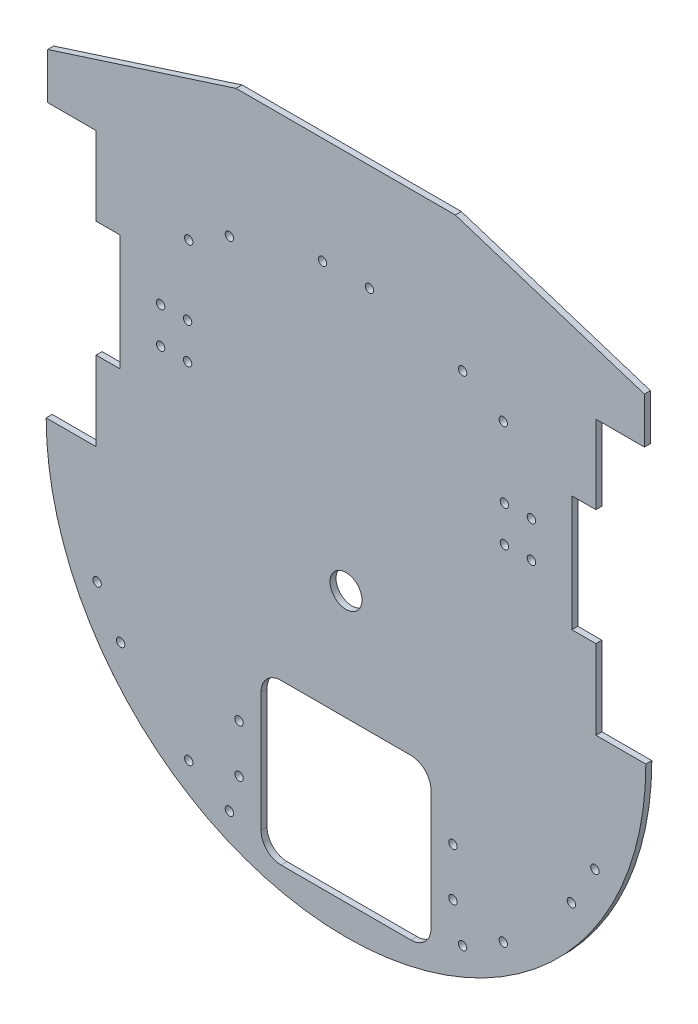
from build123d import *

# Parameters (mm, degrees)
SKETCH_1_R      = 2.1
SKETCH_1_R_2    = 8
EXTRUDE_1_DEPTH = 3


with BuildPart() as part:
    # 草图1 → 拉伸1 (new body)
    with BuildSketch(Plane.XY):
        with BuildLine():
            Line((-150, 0), (-125.000376699, 0))
            Line((-125.000376699, 0), (-125.000376699, 39.69983712))
            Line((-125.000376699, 39.69983712), (-113.000376699, 39.69983712))
            Line((-113.000376699, 39.69983712), (-113.000376699, 97.69983712))
            Line((-113.000376699, 97.69983712), (-125.000376699, 97.69983712))
            Line((-125.000376699, 97.69983712), (-125.000376699, 136.962885218))
            Line((-125.000376699, 136.962885218), (-149.291861287, 136.962885218))
            Line((-149.291861287, 136.962885218), (-149.291861287, 159.962885218))
            Line((-149.291861287, 159.962885218), (-55, 190.24809041))
            Line((-55, 190.24809041), (54.687657428, 190.24809041))
            Line((54.687657428, 190.24809041), (149.291861287, 159.962885218))
            Line((149.291861287, 159.962885218), (149.291861287, 136.962885218))
            Line((149.291861287, 136.962885218), (125.000376699, 136.962885218))
            Line((125.000376699, 136.962885218), (125.000376699, 97.69983712))
            Line((125.000376699, 97.69983712), (113.000376699, 97.69983712))
            Line((113.000376699, 97.69983712), (113.000376699, 39.69983712))
            Line((113.000376699, 39.69983712), (125.000376699, 39.69983712))
            Line((125.000376699, 39.69983712), (125.000376699, 0))
            Line((125.000376699, 0), (150, 0))
            ThreePointArc((150, 0), (0, -150), (-150, 0))
        make_face()
        with Locations((-92.750376699, 77.7)):
            Circle(SKETCH_1_R, mode=Mode.SUBTRACT)
        with Locations(Location((-92.750376699, 59.7, 0), (0, 0, 180))):
            Circle(SKETCH_1_R, mode=Mode.SUBTRACT)
        with Locations((-53.5, -83)):
            Circle(SKETCH_1_R, mode=Mode.SUBTRACT)
        with Locations(Location((-53.5, -107, 0), (0, 0, 180))):
            Circle(SKETCH_1_R, mode=Mode.SUBTRACT)
        with Locations((53.5, -107)):
            Circle(SKETCH_1_R, mode=Mode.SUBTRACT)
        with Locations(Location((53.5, -83, 0), (0, 0, 180))):
            Circle(SKETCH_1_R, mode=Mode.SUBTRACT)
        with Locations((-79.250376699, 59.7)):
            Circle(SKETCH_1_R, mode=Mode.SUBTRACT)
        with Locations(Location((-79.250376699, 77.7, 0), (0, 0, 180))):
            Circle(SKETCH_1_R, mode=Mode.SUBTRACT)
        with Locations(Location((79.250376699, 59.7, 0), (0, 0, 180))):
            Circle(SKETCH_1_R, mode=Mode.SUBTRACT)
        with Locations((92.750376699, 59.7)):
            Circle(SKETCH_1_R, mode=Mode.SUBTRACT)
        with Locations((79.250376699, 77.7)):
            Circle(SKETCH_1_R, mode=Mode.SUBTRACT)
        with Locations(Location((92.750376699, 77.7, 0), (0, 0, 180))):
            Circle(SKETCH_1_R, mode=Mode.SUBTRACT)
        Circle(SKETCH_1_R_2, mode=Mode.SUBTRACT)
        with Locations((-58.324201506, -124.520480318)):
            Circle(SKETCH_1_R, mode=Mode.SUBTRACT)
        with Locations(Location((-78.675798494, -112.770480318, 0), (0, 0, 180))):
            Circle(SKETCH_1_R, mode=Mode.SUBTRACT)
        with Locations((-112.770480318, -78.675798494)):
            Circle(SKETCH_1_R, mode=Mode.SUBTRACT)
        with Locations(Location((-124.520480318, -58.324201506, 0), (0, 0, 180))):
            Circle(SKETCH_1_R, mode=Mode.SUBTRACT)
        with Locations((-78.675798494, 112.770480318)):
            Circle(SKETCH_1_R, mode=Mode.SUBTRACT)
        with Locations(Location((-58.324201506, 124.520480318, 0), (0, 0, 180))):
            Circle(SKETCH_1_R, mode=Mode.SUBTRACT)
        with Locations((-11.75, 137)):
            Circle(SKETCH_1_R, mode=Mode.SUBTRACT)
        with Locations(Location((11.75, 137, 0), (0, 0, 180))):
            Circle(SKETCH_1_R, mode=Mode.SUBTRACT)
        with Locations((58.324201506, 124.520480318)):
            Circle(SKETCH_1_R, mode=Mode.SUBTRACT)
        with Locations(Location((78.675798494, 112.770480318, 0), (0, 0, 180))):
            Circle(SKETCH_1_R, mode=Mode.SUBTRACT)
        with Locations((124.520480318, -58.324201506)):
            Circle(SKETCH_1_R, mode=Mode.SUBTRACT)
        with Locations(Location((112.770480318, -78.675798494, 0), (0, 0, 180))):
            Circle(SKETCH_1_R, mode=Mode.SUBTRACT)
        with Locations((78.675798494, -112.770480318)):
            Circle(SKETCH_1_R, mode=Mode.SUBTRACT)
        with Locations(Location((58.324201506, -124.520480318, 0), (0, 0, 180))):
            Circle(SKETCH_1_R, mode=Mode.SUBTRACT)
        with BuildLine():
            Line((42.5, -95), (42.5, -65))
            ThreePointArc((42.5, -65), (39.571067812, -57.928932188), (32.5, -55))
            Line((32.5, -55), (-32.5, -55))
            ThreePointArc((-32.5, -55), (-39.571067812, -57.928932188), (-42.5, -65))
            Line((-42.5, -65), (-42.5, -95))
            Line((-42.5, -95), (-42.5, -125))
            ThreePointArc((-42.5, -125), (-39.571067812, -132.071067812), (-32.5, -135))
            Line((-32.5, -135), (32.5, -135))
            ThreePointArc((32.5, -135), (39.571067812, -132.071067812), (42.5, -125))
            Line((42.5, -125), (42.5, -95))
        make_face(mode=Mode.SUBTRACT)
    extrude(amount=EXTRUDE_1_DEPTH)


solid = part.part
